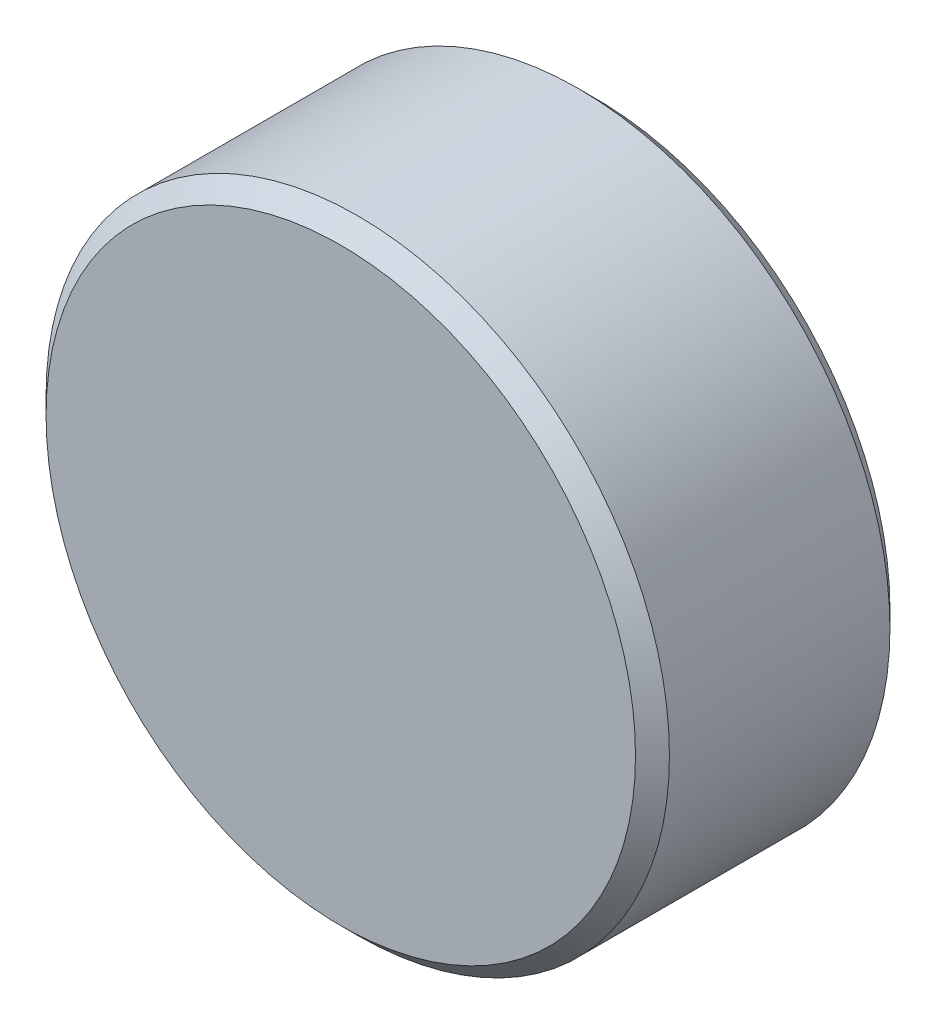
from build123d import *

# Parameters (mm, degrees)
ESQUISSE1_R      = 36.75
EXTRUSION1_DEPTH = 30
CHANFREIN1_SIZE  = 2
CHANFREIN2_SIZE  = 2


with BuildPart() as part:
    # Esquisse1 → Extrusion1 (new body)
    with BuildSketch(Plane.XY):
        Circle(ESQUISSE1_R)
    extrude(amount=EXTRUSION1_DEPTH)

    # Chanfrein1
    chanfrein1_edges = [part.edges().sort_by_distance(p)[0] for p in [
        (-36.75, 0, 30),
    ]]
    chamfer(chanfrein1_edges, length=CHANFREIN1_SIZE)

    # Chanfrein2
    chanfrein2_edges = [part.edges().sort_by_distance(p)[0] for p in [
        (-36.75, 0, 0),
    ]]
    chamfer(chanfrein2_edges, length=CHANFREIN2_SIZE)


solid = part.part
